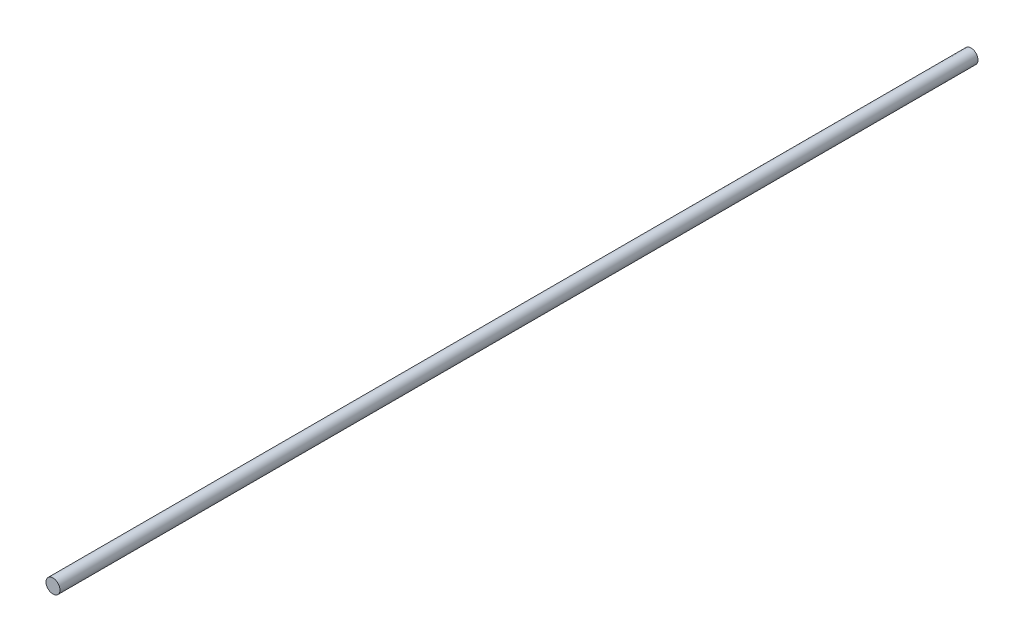
from build123d import *

# Parameters (mm, degrees)
SKETCH1_R           = 1.5
BOSS_EXTRUDE1_DEPTH = 98.5


with BuildPart() as part:
    # Sketch1 → Boss-Extrude1 (new, symmetric)
    with BuildSketch(Plane.XY):
        Circle(SKETCH1_R)
    extrude(amount=BOSS_EXTRUDE1_DEPTH, both=True)


solid = part.part
